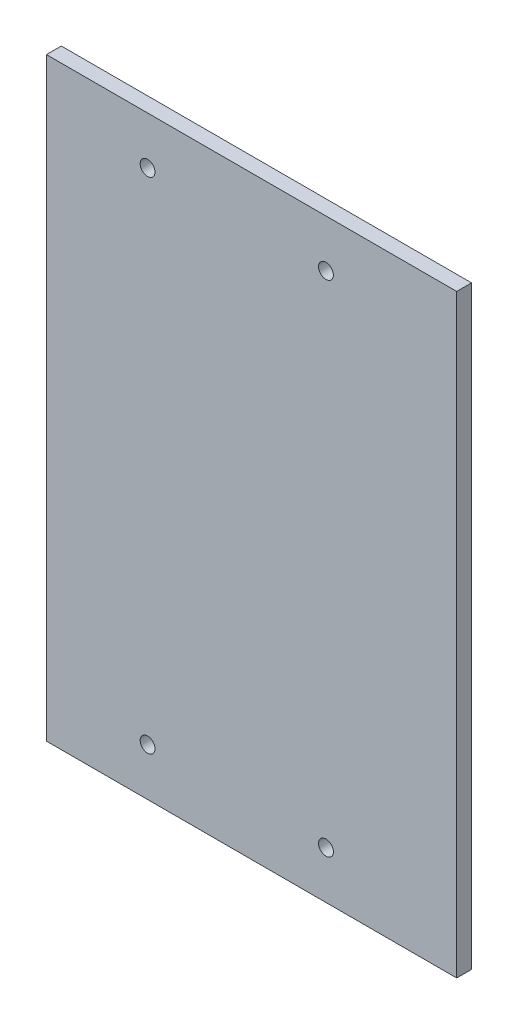
from build123d import *

# Parameters (mm, degrees)
ESQUISSE1_W             = 110
ESQUISSE1_H             = 200
BOSS_EXTRU_1_DEPTH      = 5
ESQUISSE28_R            = 2.5
ENL_V_MAT_EXTRU_1_DEPTH = 115.236596588
ESQUISSE29_W            = 5
ESQUISSE29_H            = 200
BOSS_EXTRU_2_DEPTH      = 28


with BuildPart() as part:
    # Esquisse1 → Boss.-Extru.1 (new body)
    with BuildSketch(Plane.XY):
        Rectangle(ESQUISSE1_W, ESQUISSE1_H)
    extrude(amount=BOSS_EXTRU_1_DEPTH)

    # Esquisse28 → Enlèv. mat.-Extru.1 (cut, through all)
    with BuildSketch(Plane(origin=(0, 0, 0), x_dir=(-1, 0, 0), z_dir=(0, 0, -1))):
        with Locations((20.980762114, -84)):
            Circle(ESQUISSE28_R)
        with Locations((-39.019237886, -84)):
            Circle(ESQUISSE28_R)
        with Locations((20.980762114, 84)):
            Circle(ESQUISSE28_R)
        with Locations((-39.019237886, 84)):
            Circle(ESQUISSE28_R)
    extrude(amount=-ENL_V_MAT_EXTRU_1_DEPTH, mode=Mode.SUBTRACT)

    # Esquisse29 → Boss.-Extru.2 (add)
    with BuildSketch(Plane(origin=(55, 0, 0), x_dir=(0, 0, -1), z_dir=(1, 0, 0))):
        with Locations((-2.5, 0)):
            Rectangle(ESQUISSE29_W, ESQUISSE29_H)
    extrude(amount=BOSS_EXTRU_2_DEPTH)


solid = part.part
